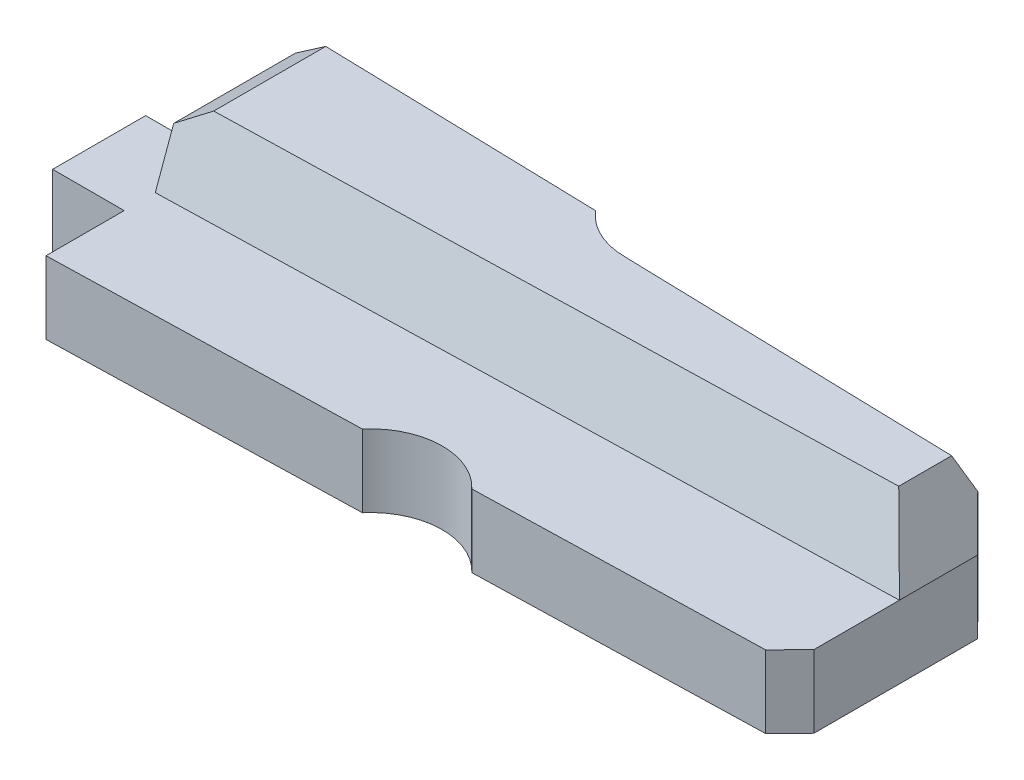
from build123d import *

# Parameters (mm, degrees)
BOSS_EXTRUDE1_DEPTH = 6.08
BOSS_EXTRUDE2_DEPTH = 6.09
SKETCH4_W           = 70.899698082
SKETCH4_H           = 9.313865989
CUT_EXTRUDE4_DEPTH  = 13.09
SKETCH5_W           = 29.305939782
SKETCH5_H           = 12.234342693
CUT_EXTRUDE5_DEPTH  = 19.09
SKETCH6_R           = 6
CUT_EXTRUDE6_DEPTH  = 60.839839878
CUT_EXTRUDE7_DEPTH  = 11.09
SKETCH10_W          = 36.097359295
SKETCH10_H          = 22.987225517
CUT_EXTRUDE11_DEPTH = 63.929843377
SKETCH12_W          = 7.8
SKETCH12_H          = 6.08
BOSS_EXTRUDE4_DEPTH = 6
CUT_EXTRUDE12_REACH = 66.913
SKETCH13_W          = 18.746233403
SKETCH13_H          = 9.142839949


with BuildPart() as part:
    # Sketch1 → Boss-Extrude1 (new body)
    with BuildSketch(Plane(origin=(0, 0, 0), x_dir=(1, 0, 0), z_dir=(0, 1, 0))):
        Polygon((-14.914047624, 10.796093069), (-14.914047624, -10.733906931), (57.585952376, -8.821379846), (57.585952376, 8.878620154), align=None)
    extrude(amount=BOSS_EXTRUDE1_DEPTH)

    # Sketch2 → Boss-Extrude2 (add)
    with BuildSketch(Plane(origin=(0, 6.08, 0), x_dir=(1, 0, 0), z_dir=(0, 1, 0))):
        Polygon((-13.064047624, 10.74716445), (-13.064047624, -1.521917904), (57.585952376, 0.341806766), (57.585952376, 8.878620154), align=None)
    extrude(amount=BOSS_EXTRUDE2_DEPTH)

    # Sketch4 → Cut-Extrude4 (cut)
    with BuildSketch(Plane(origin=(0.078934537, 1.089467811, 2.992247256), x_dir=(0.9996522376299903, 0, -0.026370510070028146), z_dir=(0.02478017371916596, 0.34202014332566605, 0.9393658310530242))):
        with Locations((22.35021085, 9.967746424)):
            Rectangle(SKETCH4_W, SKETCH4_H)
    extrude(amount=CUT_EXTRUDE4_DEPTH, mode=Mode.SUBTRACT)

    # Sketch5 → Cut-Extrude5 (cut)
    with BuildSketch(Plane(origin=(52.803749931, 19.218993233, 0), x_dir=(0, 0, -1), z_dir=(0.9396926207859081, 0.34202014332566943, 1.2295842975475839e-15))):
        with Locations((0.411188199, -7.865053205)):
            Rectangle(SKETCH5_W, SKETCH5_H)
    extrude(amount=CUT_EXTRUDE5_DEPTH, mode=Mode.SUBTRACT)

    # Sketch6 → Cut-Extrude6 (cut, through all)
    with BuildSketch(Plane.XZ):
        with Locations((27.215952376, 13.62392238)):
            Circle(SKETCH6_R)
        with Locations((27.215952376, -13.683241685)):
            Circle(SKETCH6_R)
        Polygon((-14.914047624, 10.733906931), (-14.914047624, 8.733906931), (-12.914047624, 10.681147563), align=None)
        Polygon((-14.914047624, -10.796093069), (-12.914047624, -10.743197265), (-14.914047624, -8.796093069), align=None)
        Polygon((55.586647901, 8.874120866), (57.585952376, 8.821379846), (57.585952376, 6.821379846), align=None)
        Polygon((57.585952376, -8.878620154), (57.585952376, -6.878620154), (55.585952376, -8.931515959), align=None)
    extrude(amount=-CUT_EXTRUDE6_DEPTH, mode=Mode.SUBTRACT)

    # Sketch7 → Cut-Extrude7 (cut)
    with BuildSketch(Plane(origin=(0.305261026, 5.260141687, -11.541974951), x_dir=(-0.9997105289622884, 0.009976365195544153, -0.021893615951381312), z_dir=(0.024059473814631405, 0.4145836859950284, -0.9096930850712998))):
        Polygon((-26.921663821, 7.88786599), (-26.921663821, 3.064364781), (-63.575410801, 3.466220434), (-63.575410801, 10.38968732), (-26.921663821, 9.987831666), align=None)
    extrude(amount=CUT_EXTRUDE7_DEPTH, mode=Mode.SUBTRACT)

    # Sketch10 → Cut-Extrude11 (cut, through all)
    with BuildSketch(Plane.ZY.offset(3.214047624)):
        with Locations((0.41938451, 3.731019242)):
            Rectangle(SKETCH10_W, SKETCH10_H)
    extrude(amount=CUT_EXTRUDE11_DEPTH, mode=Mode.SUBTRACT)

    # Sketch12 → Boss-Extrude4 (add)
    with BuildSketch(Plane.ZY.offset(3.214047624)):
        with Locations((-0.030693992, 3.04)):
            Rectangle(SKETCH12_W, SKETCH12_H)
    extrude(amount=BOSS_EXTRUDE4_DEPTH)

    # Sketch13 → Cut-Extrude12 (cut, up to next)
    with BuildSketch(Plane(origin=(-5.91505424, 8.447572923, 0), x_dir=(0, 0, 1), z_dir=(-0.5735764363510444, 0.819152044288993, 0)), mode=Mode.PRIVATE) as cut_extrude12_sk1:
        with Locations((-4.290942315, 4.9788615)):
            Rectangle(SKETCH13_W, SKETCH13_H)
    cut_extrude12_tool1 = extrude(cut_extrude12_sk1.sketch, amount=CUT_EXTRUDE12_REACH, mode=Mode.PRIVATE) & part.part
    add(cut_extrude12_tool1.solids().sort_by_distance((-1.83661, 11.303331, -4.290942))[0], mode=Mode.SUBTRACT)


solid = part.part
